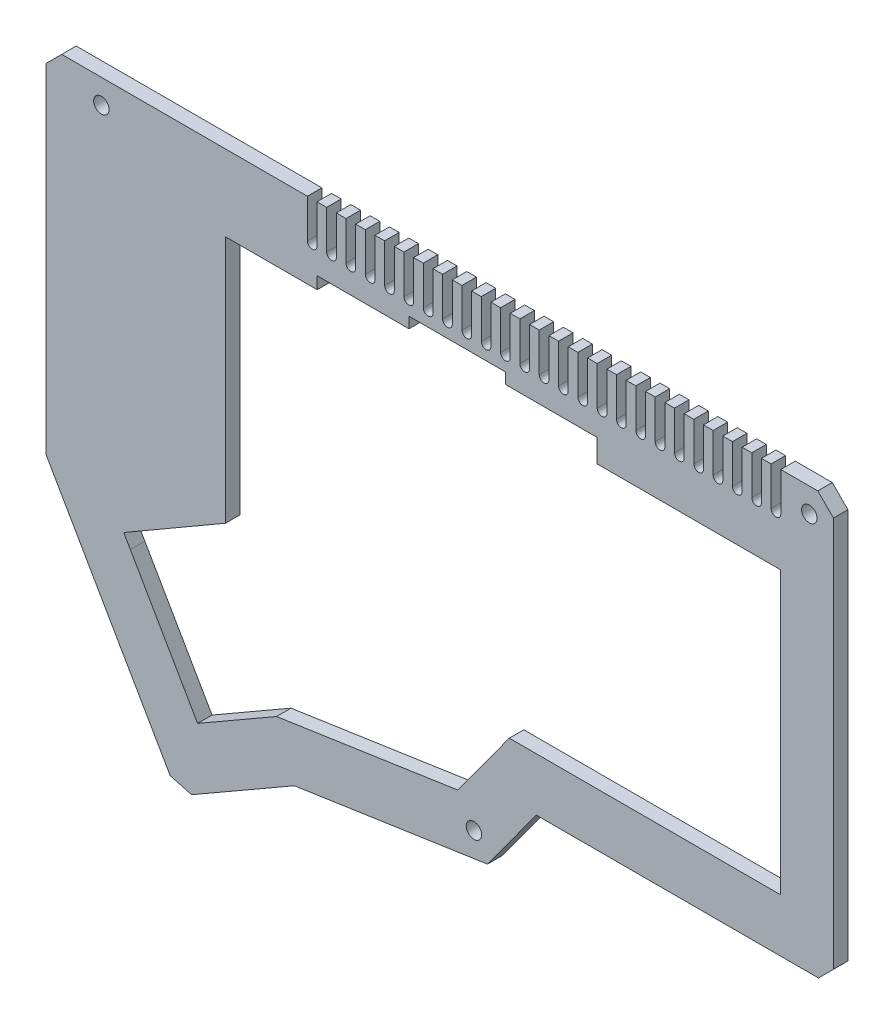
from build123d import *

# Parameters (mm, degrees)
ESQUISSE1_R             = 1.6
BOSS_EXTRU_1_DEPTH      = 3
ENL_V_MAT_EXTRU_1_DEPTH = 10


with BuildPart() as part:
    # Esquisse1 → Boss.-Extru.1 (new body)
    with BuildSketch(Plane.XY):
        Polygon((5.525007543, 0.072428093), (2.276763789, 3.320852512), (-154.236345188, 3.320852512), (-157.478985875, 0.078211825), (-157.478985875, -70.04068474), (-131.779420125, -114.771472067), (-127.355917516, -115.9649154), (-106.081983802, -103.720194839), (-66.092540926, -97.775797545), (-55.98795635, -83.933633781), (2.418252352, -83.933633781), (5.525007543, -80.826878591), align=None)
        Polygon((-126.111124489, -102.556497988), (-140.02282508, -78.342807898), (-141.407217303, -75.981121034), (-120.346626934, -63.796065222), (-120.346308835, -12.429484403), (-101.345774335, -12.429484403), (-101.345774335, -9.929307079), (-82.344426674, -9.929307079), (-82.344426674, -7.679926158), (-62.343149943, -7.681038584), (-62.343149943, -9.929307079), (-43.477687779, -9.929307079), (-43.477687779, -14.679643994), (-5.474992457, -14.679643994), (-5.474992457, -72.933633781), (-61.577157206, -72.933633781), (-72.263087593, -87.572177036), (-109.761976756, -93.1463556), align=None, mode=Mode.SUBTRACT)
        with Locations((-68.897334865, -93.137788223)):
            Circle(ESQUISSE1_R, mode=Mode.SUBTRACT)
        with Locations((-146.02282508, -1.677868186)):
            Circle(ESQUISSE1_R, mode=Mode.SUBTRACT)
        with Locations((0.525007543, -1.68453516)):
            Circle(ESQUISSE1_R, mode=Mode.SUBTRACT)
    extrude(amount=BOSS_EXTRU_1_DEPTH)

    # Esquisse2 → Enlèv. mat.-Extru.1 (cut)
    with BuildSketch(Plane.XY.offset(3)):
        with BuildLine():
            Line((-5.386559375, 6.054162745), (-5.386559375, -4.679147488))
            ThreePointArc((-5.386559375, -4.679147488), (-6.386559375, -5.679147488), (-7.386559375, -4.679147488))
            Line((-7.386559375, -4.679147488), (-7.386559375, 6.054162745))
            ThreePointArc((-7.386559375, 6.054162745), (-6.386559375, 7.054162745), (-5.386559375, 6.054162745))
        make_face()
        with BuildLine():
            Line((-9.386559375, 6.054162745), (-9.386559375, -4.679147488))
            ThreePointArc((-9.386559375, -4.679147488), (-10.386559375, -5.679147488), (-11.386559375, -4.679147488))
            Line((-11.386559375, -4.679147488), (-11.386559375, 6.054162745))
            ThreePointArc((-11.386559375, 6.054162745), (-10.386559375, 7.054162745), (-9.386559375, 6.054162745))
        make_face()
        with BuildLine():
            Line((-13.386559375, 6.054162745), (-13.386559375, -4.679147488))
            ThreePointArc((-13.386559375, -4.679147488), (-14.386559375, -5.679147488), (-15.386559375, -4.679147488))
            Line((-15.386559375, -4.679147488), (-15.386559375, 6.054162745))
            ThreePointArc((-15.386559375, 6.054162745), (-14.386559375, 7.054162745), (-13.386559375, 6.054162745))
        make_face()
        with BuildLine():
            Line((-17.386559375, 6.054162745), (-17.386559375, -4.679147488))
            ThreePointArc((-17.386559375, -4.679147488), (-18.386559375, -5.679147488), (-19.386559375, -4.679147488))
            Line((-19.386559375, -4.679147488), (-19.386559375, 6.054162745))
            ThreePointArc((-19.386559375, 6.054162745), (-18.386559375, 7.054162745), (-17.386559375, 6.054162745))
        make_face()
        with BuildLine():
            Line((-21.386559375, 6.054162745), (-21.386559375, -4.679147488))
            ThreePointArc((-21.386559375, -4.679147488), (-22.386559375, -5.679147488), (-23.386559375, -4.679147488))
            Line((-23.386559375, -4.679147488), (-23.386559375, 6.054162745))
            ThreePointArc((-23.386559375, 6.054162745), (-22.386559375, 7.054162745), (-21.386559375, 6.054162745))
        make_face()
        with BuildLine():
            Line((-25.386559375, 6.054162745), (-25.386559375, -4.679147488))
            ThreePointArc((-25.386559375, -4.679147488), (-26.386559375, -5.679147488), (-27.386559375, -4.679147488))
            Line((-27.386559375, -4.679147488), (-27.386559375, 6.054162745))
            ThreePointArc((-27.386559375, 6.054162745), (-26.386559375, 7.054162745), (-25.386559375, 6.054162745))
        make_face()
        with BuildLine():
            Line((-29.386559375, 6.054162745), (-29.386559375, -4.679147488))
            ThreePointArc((-29.386559375, -4.679147488), (-30.386559375, -5.679147488), (-31.386559375, -4.679147488))
            Line((-31.386559375, -4.679147488), (-31.386559375, 6.054162745))
            ThreePointArc((-31.386559375, 6.054162745), (-30.386559375, 7.054162745), (-29.386559375, 6.054162745))
        make_face()
        with BuildLine():
            Line((-33.386559375, 6.054162745), (-33.386559375, -4.679147488))
            ThreePointArc((-33.386559375, -4.679147488), (-34.386559375, -5.679147488), (-35.386559375, -4.679147488))
            Line((-35.386559375, -4.679147488), (-35.386559375, 6.054162745))
            ThreePointArc((-35.386559375, 6.054162745), (-34.386559375, 7.054162745), (-33.386559375, 6.054162745))
        make_face()
        with BuildLine():
            Line((-37.386559375, 6.054162745), (-37.386559375, -4.679147488))
            ThreePointArc((-37.386559375, -4.679147488), (-38.386559375, -5.679147488), (-39.386559375, -4.679147488))
            Line((-39.386559375, -4.679147488), (-39.386559375, 6.054162745))
            ThreePointArc((-39.386559375, 6.054162745), (-38.386559375, 7.054162745), (-37.386559375, 6.054162745))
        make_face()
        with BuildLine():
            Line((-41.386559375, 6.054162745), (-41.386559375, -4.679147488))
            ThreePointArc((-41.386559375, -4.679147488), (-42.386559375, -5.679147488), (-43.386559375, -4.679147488))
            Line((-43.386559375, -4.679147488), (-43.386559375, 6.054162745))
            ThreePointArc((-43.386559375, 6.054162745), (-42.386559375, 7.054162745), (-41.386559375, 6.054162745))
        make_face()
        with BuildLine():
            Line((-45.386559375, 6.054162745), (-45.386559375, -4.679147488))
            ThreePointArc((-45.386559375, -4.679147488), (-46.386559375, -5.679147488), (-47.386559375, -4.679147488))
            Line((-47.386559375, -4.679147488), (-47.386559375, 6.054162745))
            ThreePointArc((-47.386559375, 6.054162745), (-46.386559375, 7.054162745), (-45.386559375, 6.054162745))
        make_face()
        with BuildLine():
            Line((-49.386559375, 6.054162745), (-49.386559375, -4.679147488))
            ThreePointArc((-49.386559375, -4.679147488), (-50.386559375, -5.679147488), (-51.386559375, -4.679147488))
            Line((-51.386559375, -4.679147488), (-51.386559375, 6.054162745))
            ThreePointArc((-51.386559375, 6.054162745), (-50.386559375, 7.054162745), (-49.386559375, 6.054162745))
        make_face()
        with BuildLine():
            Line((-53.386559375, 6.054162745), (-53.386559375, -4.679147488))
            ThreePointArc((-53.386559375, -4.679147488), (-54.386559375, -5.679147488), (-55.386559375, -4.679147488))
            Line((-55.386559375, -4.679147488), (-55.386559375, 6.054162745))
            ThreePointArc((-55.386559375, 6.054162745), (-54.386559375, 7.054162745), (-53.386559375, 6.054162745))
        make_face()
        with BuildLine():
            Line((-57.386559375, 6.054162745), (-57.386559375, -4.679147488))
            ThreePointArc((-57.386559375, -4.679147488), (-58.386559375, -5.679147488), (-59.386559375, -4.679147488))
            Line((-59.386559375, -4.679147488), (-59.386559375, 6.054162745))
            ThreePointArc((-59.386559375, 6.054162745), (-58.386559375, 7.054162745), (-57.386559375, 6.054162745))
        make_face()
        with BuildLine():
            Line((-61.386559375, 6.054162745), (-61.386559375, -4.679147488))
            ThreePointArc((-61.386559375, -4.679147488), (-62.386559375, -5.679147488), (-63.386559375, -4.679147488))
            Line((-63.386559375, -4.679147488), (-63.386559375, 6.054162745))
            ThreePointArc((-63.386559375, 6.054162745), (-62.386559375, 7.054162745), (-61.386559375, 6.054162745))
        make_face()
        with BuildLine():
            Line((-65.386559375, 6.054162745), (-65.386559375, -4.679147488))
            ThreePointArc((-65.386559375, -4.679147488), (-66.386559375, -5.679147488), (-67.386559375, -4.679147488))
            Line((-67.386559375, -4.679147488), (-67.386559375, 6.054162745))
            ThreePointArc((-67.386559375, 6.054162745), (-66.386559375, 7.054162745), (-65.386559375, 6.054162745))
        make_face()
        with BuildLine():
            Line((-69.386559375, 6.054162745), (-69.386559375, -4.679147488))
            ThreePointArc((-69.386559375, -4.679147488), (-70.386559375, -5.679147488), (-71.386559375, -4.679147488))
            Line((-71.386559375, -4.679147488), (-71.386559375, 6.054162745))
            ThreePointArc((-71.386559375, 6.054162745), (-70.386559375, 7.054162745), (-69.386559375, 6.054162745))
        make_face()
        with BuildLine():
            Line((-73.386559375, 6.054162745), (-73.386559375, -4.679147488))
            ThreePointArc((-73.386559375, -4.679147488), (-74.386559375, -5.679147488), (-75.386559375, -4.679147488))
            Line((-75.386559375, -4.679147488), (-75.386559375, 6.054162745))
            ThreePointArc((-75.386559375, 6.054162745), (-74.386559375, 7.054162745), (-73.386559375, 6.054162745))
        make_face()
        with BuildLine():
            Line((-77.386559375, 6.054162745), (-77.386559375, -4.679147488))
            ThreePointArc((-77.386559375, -4.679147488), (-78.386559375, -5.679147488), (-79.386559375, -4.679147488))
            Line((-79.386559375, -4.679147488), (-79.386559375, 6.054162745))
            ThreePointArc((-79.386559375, 6.054162745), (-78.386559375, 7.054162745), (-77.386559375, 6.054162745))
        make_face()
        with BuildLine():
            Line((-81.386559375, 6.054162745), (-81.386559375, -4.679147488))
            ThreePointArc((-81.386559375, -4.679147488), (-82.386559375, -5.679147488), (-83.386559375, -4.679147488))
            Line((-83.386559375, -4.679147488), (-83.386559375, 6.054162745))
            ThreePointArc((-83.386559375, 6.054162745), (-82.386559375, 7.054162745), (-81.386559375, 6.054162745))
        make_face()
        with BuildLine():
            Line((-85.386559375, 6.054162745), (-85.386559375, -4.679147488))
            ThreePointArc((-85.386559375, -4.679147488), (-86.386559375, -5.679147488), (-87.386559375, -4.679147488))
            Line((-87.386559375, -4.679147488), (-87.386559375, 6.054162745))
            ThreePointArc((-87.386559375, 6.054162745), (-86.386559375, 7.054162745), (-85.386559375, 6.054162745))
        make_face()
        with BuildLine():
            Line((-89.386559375, 6.054162745), (-89.386559375, -4.679147488))
            ThreePointArc((-89.386559375, -4.679147488), (-90.386559375, -5.679147488), (-91.386559375, -4.679147488))
            Line((-91.386559375, -4.679147488), (-91.386559375, 6.054162745))
            ThreePointArc((-91.386559375, 6.054162745), (-90.386559375, 7.054162745), (-89.386559375, 6.054162745))
        make_face()
        with BuildLine():
            Line((-93.386559375, 6.054162745), (-93.386559375, -4.679147488))
            ThreePointArc((-93.386559375, -4.679147488), (-94.386559375, -5.679147488), (-95.386559375, -4.679147488))
            Line((-95.386559375, -4.679147488), (-95.386559375, 6.054162745))
            ThreePointArc((-95.386559375, 6.054162745), (-94.386559375, 7.054162745), (-93.386559375, 6.054162745))
        make_face()
        with BuildLine():
            Line((-97.386559375, 6.054162745), (-97.386559375, -4.679147488))
            ThreePointArc((-97.386559375, -4.679147488), (-98.386559375, -5.679147488), (-99.386559375, -4.679147488))
            Line((-99.386559375, -4.679147488), (-99.386559375, 6.054162745))
            ThreePointArc((-99.386559375, 6.054162745), (-98.386559375, 7.054162745), (-97.386559375, 6.054162745))
        make_face()
        with BuildLine():
            Line((-101.386559375, 6.054162745), (-101.386559375, -4.679147488))
            ThreePointArc((-101.386559375, -4.679147488), (-102.386559375, -5.679147488), (-103.386559375, -4.679147488))
            Line((-103.386559375, -4.679147488), (-103.386559375, 6.054162745))
            ThreePointArc((-103.386559375, 6.054162745), (-102.386559375, 7.054162745), (-101.386559375, 6.054162745))
        make_face()
    extrude(amount=-ENL_V_MAT_EXTRU_1_DEPTH, mode=Mode.SUBTRACT)


solid = part.part
